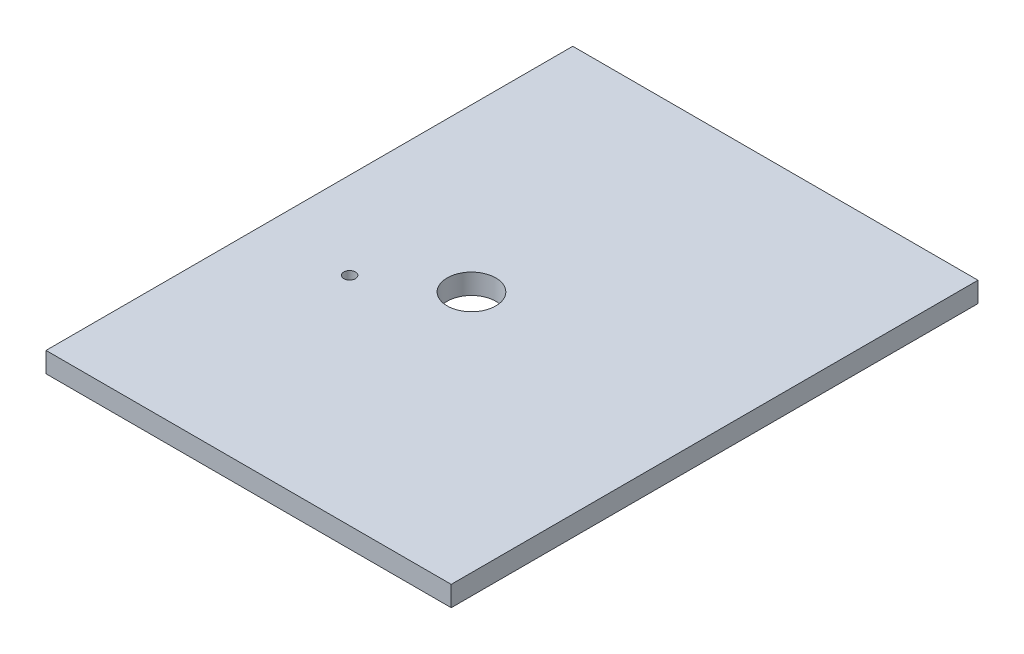
from build123d import *

# Parameters (mm, degrees)
SKETCH1_W           = 100
SKETCH1_H           = 130
SKETCH1_R           = 6
SKETCH1_R_2         = 1.444174109
BOSS_EXTRUDE1_DEPTH = 5


with BuildPart() as part:
    # Sketch1 → Boss-Extrude1 (new body)
    with BuildSketch(Plane(origin=(0, 0, 0), x_dir=(1, 0, 0), z_dir=(0, 1, 0))):
        with Locations((23.349056604, 39.646226415)):
            Rectangle(SKETCH1_W, SKETCH1_H)
        with Locations(Location((13.349056604, 39.646226415, 0), (0, 0, 270))):
            Circle(SKETCH1_R, mode=Mode.SUBTRACT)
        with Locations(Location((-5.23521012, 28.165697553, 0), (0, 0, 270))):
            Circle(SKETCH1_R_2, mode=Mode.SUBTRACT)
    extrude(amount=BOSS_EXTRUDE1_DEPTH)


solid = part.part
